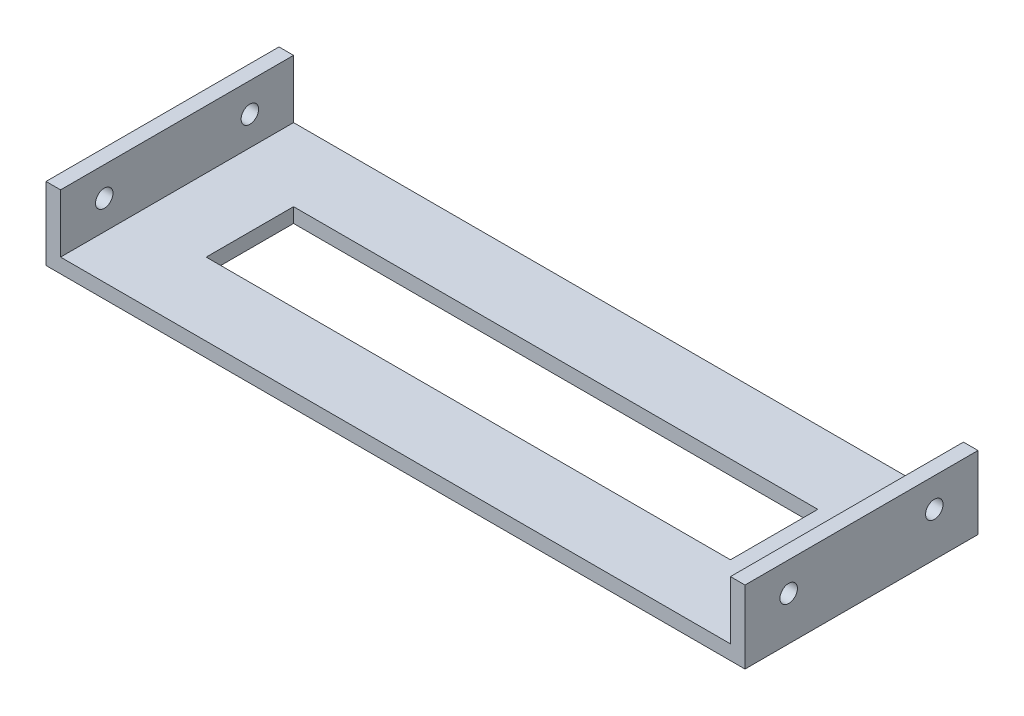
from build123d import *

# Parameters (mm, degrees)
SKETCH1_W           = 240
SKETCH1_H           = 80
SKETCH1_W_2         = 180
SKETCH1_H_2         = 30
BOSS_EXTRUDE1_DEPTH = 5
SKETCH2_W           = 5
SKETCH2_H           = 80
BOSS_EXTRUDE2_DEPTH = 20
SKETCH4_W           = 5
SKETCH4_H           = 80
BOSS_EXTRUDE3_DEPTH = 20
SKETCH3_R           = 3
CUT_EXTRUDE1_DEPTH  = 245.591496173


with BuildPart() as part:
    # Sketch1 → Boss-Extrude1 (new body)
    with BuildSketch(Plane(origin=(0, 0, 0), x_dir=(1, 0, 0), z_dir=(0, 1, 0))):
        Rectangle(SKETCH1_W, SKETCH1_H)
        Rectangle(SKETCH1_W_2, SKETCH1_H_2, mode=Mode.SUBTRACT)
    extrude(amount=BOSS_EXTRUDE1_DEPTH)

    # Sketch2 → Boss-Extrude2 (add)
    with BuildSketch(Plane(origin=(0, 5, 0), x_dir=(1, 0, 0), z_dir=(0, 1, 0))):
        with Locations((117.5, 0)):
            Rectangle(SKETCH2_W, SKETCH2_H)
    extrude(amount=BOSS_EXTRUDE2_DEPTH)

    # Sketch4 → Boss-Extrude3 (add)
    with BuildSketch(Plane(origin=(0, 5, 0), x_dir=(1, 0, 0), z_dir=(0, 1, 0))):
        with Locations((-117.5, 0)):
            Rectangle(SKETCH4_W, SKETCH4_H)
    extrude(amount=BOSS_EXTRUDE3_DEPTH)

    # Sketch3 → Cut-Extrude1 (cut, through all)
    with BuildSketch(Plane(origin=(120, 0, 0), x_dir=(0, 0, -1), z_dir=(1, 0, 0))):
        with Locations((-25, 15)):
            Circle(SKETCH3_R)
        with Locations(Location((25, 15, 0), (0, 0, 180))):
            Circle(SKETCH3_R)
    extrude(amount=-CUT_EXTRUDE1_DEPTH, mode=Mode.SUBTRACT)


solid = part.part
